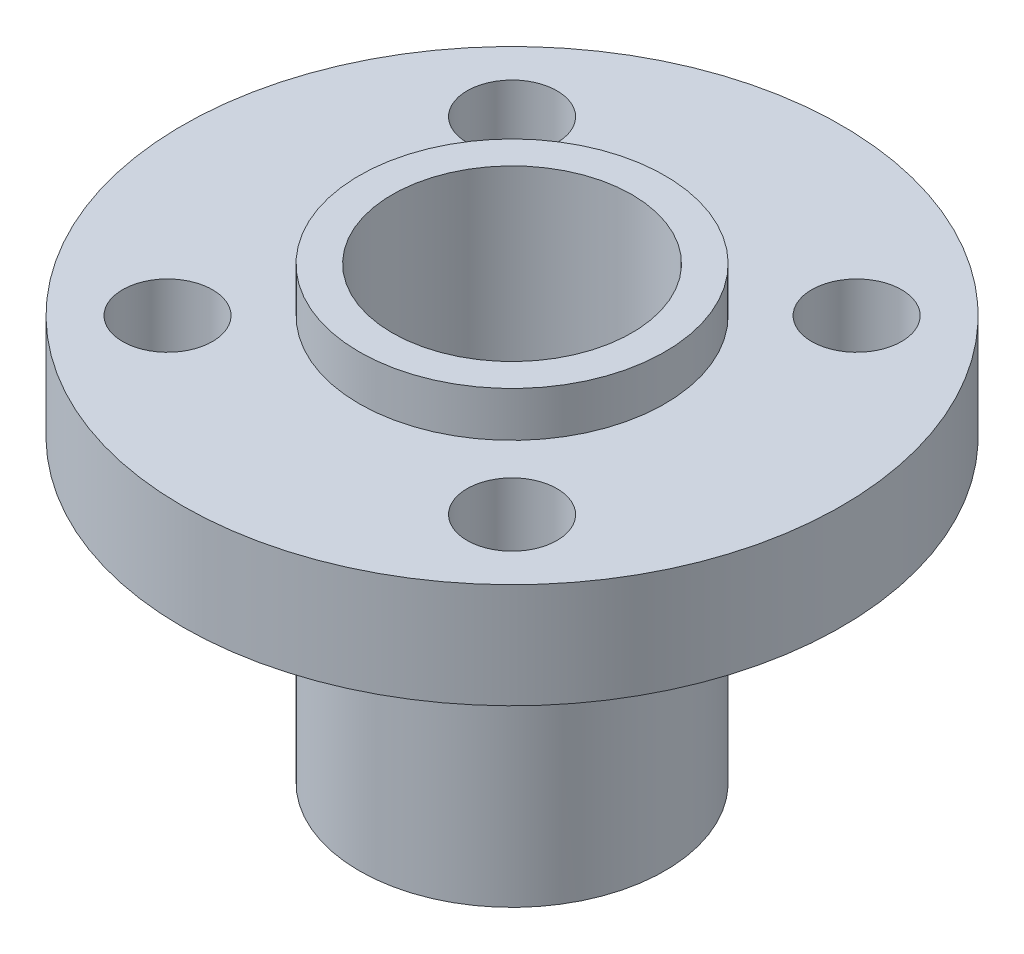
from build123d import *

# Parameters (mm, degrees)
SKETCH1_R           = 11
SKETCH1_R_2         = 4
BOSS_EXTRUDE1_DEPTH = 3.5
SKETCH2_R           = 5.1
SKETCH2_R_2         = 4
BOSS_EXTRUDE2_DEPTH = 1.5
BOSS_EXTRUDE3_START = 10
SKETCH3_R           = 5.1
SKETCH3_R_2         = 4
BOSS_EXTRUDE3_DEPTH = 10
CUT_EXTRUDE1_REACH  = 22.597
SKETCH4_R           = 1.5


with BuildPart() as part:
    # Sketch1 → Boss-Extrude1 (new body)
    with BuildSketch(Plane(origin=(0, 0, 0), x_dir=(1, 0, 0), z_dir=(0, 1, 0))):
        with Locations(Location((0, 0, 0), (0, 0, 270))):
            Circle(SKETCH1_R)
        with Locations(Location((0, 0, 0), (0, 0, 270))):
            Circle(SKETCH1_R_2, mode=Mode.SUBTRACT)
    extrude(amount=BOSS_EXTRUDE1_DEPTH)

    # Sketch2 → Boss-Extrude2 (add)
    with BuildSketch(Plane(origin=(0, 3.5, 0), x_dir=(1, 0, 0), z_dir=(0, 1, 0))):
        with Locations(Location((0, 0, 0), (0, 0, 270))):
            Circle(SKETCH2_R)
        with Locations(Location((0, 0, 0), (0, 0, 270))):
            Circle(SKETCH2_R_2, mode=Mode.SUBTRACT)
    extrude(amount=BOSS_EXTRUDE2_DEPTH)

    # Sketch3 → Boss-Extrude3 (add)
    with BuildSketch(Plane.XZ.offset(BOSS_EXTRUDE3_START)):
        with Locations(Location((0, 0, 0), (0, 0, 90))):
            Circle(SKETCH3_R)
        with Locations(Location((0, 0, 0), (0, 0, 270))):
            Circle(SKETCH3_R_2, mode=Mode.SUBTRACT)
    extrude(amount=-BOSS_EXTRUDE3_DEPTH)

    # Sketch4 → Cut-Extrude1 (cut, up to next)
    with BuildSketch(Plane(origin=(0, 3.5, 0), x_dir=(1, 0, 0), z_dir=(0, 1, 0)), mode=Mode.PRIVATE) as cut_extrude1_sk1:
        with Locations(Location((-5.75, 5.75, 0), (0, 0, 270))):
            Circle(SKETCH4_R)
    cut_extrude1_tool1 = extrude(cut_extrude1_sk1.sketch, amount=-CUT_EXTRUDE1_REACH, mode=Mode.PRIVATE) & part.part
    # Sketch4 → Cut-Extrude1 (cut, up to next)
    with BuildSketch(Plane(origin=(0, 3.5, 0), x_dir=(1, 0, 0), z_dir=(0, 1, 0)), mode=Mode.PRIVATE) as cut_extrude1_sk2:
        with Locations(Location((5.75, 5.75, 0), (0, 0, 270))):
            Circle(SKETCH4_R)
    cut_extrude1_tool2 = extrude(cut_extrude1_sk2.sketch, amount=-CUT_EXTRUDE1_REACH, mode=Mode.PRIVATE) & part.part
    # Sketch4 → Cut-Extrude1 (cut, up to next)
    with BuildSketch(Plane(origin=(0, 3.5, 0), x_dir=(1, 0, 0), z_dir=(0, 1, 0)), mode=Mode.PRIVATE) as cut_extrude1_sk3:
        with Locations(Location((5.75, -5.75, 0), (0, 0, 270))):
            Circle(SKETCH4_R)
    cut_extrude1_tool3 = extrude(cut_extrude1_sk3.sketch, amount=-CUT_EXTRUDE1_REACH, mode=Mode.PRIVATE) & part.part
    # Sketch4 → Cut-Extrude1 (cut, up to next)
    with BuildSketch(Plane(origin=(0, 3.5, 0), x_dir=(1, 0, 0), z_dir=(0, 1, 0)), mode=Mode.PRIVATE) as cut_extrude1_sk4:
        with Locations(Location((-5.75, -5.75, 0), (0, 0, 270))):
            Circle(SKETCH4_R)
    cut_extrude1_tool4 = extrude(cut_extrude1_sk4.sketch, amount=-CUT_EXTRUDE1_REACH, mode=Mode.PRIVATE) & part.part
    add(cut_extrude1_tool1.solids().sort_by_distance((-5.75, 3.5, -5.75))[0], mode=Mode.SUBTRACT)
    add(cut_extrude1_tool2.solids().sort_by_distance((5.75, 3.5, -5.75))[0], mode=Mode.SUBTRACT)
    add(cut_extrude1_tool3.solids().sort_by_distance((5.75, 3.5, 5.75))[0], mode=Mode.SUBTRACT)
    add(cut_extrude1_tool4.solids().sort_by_distance((-5.75, 3.5, 5.75))[0], mode=Mode.SUBTRACT)


solid = part.part
